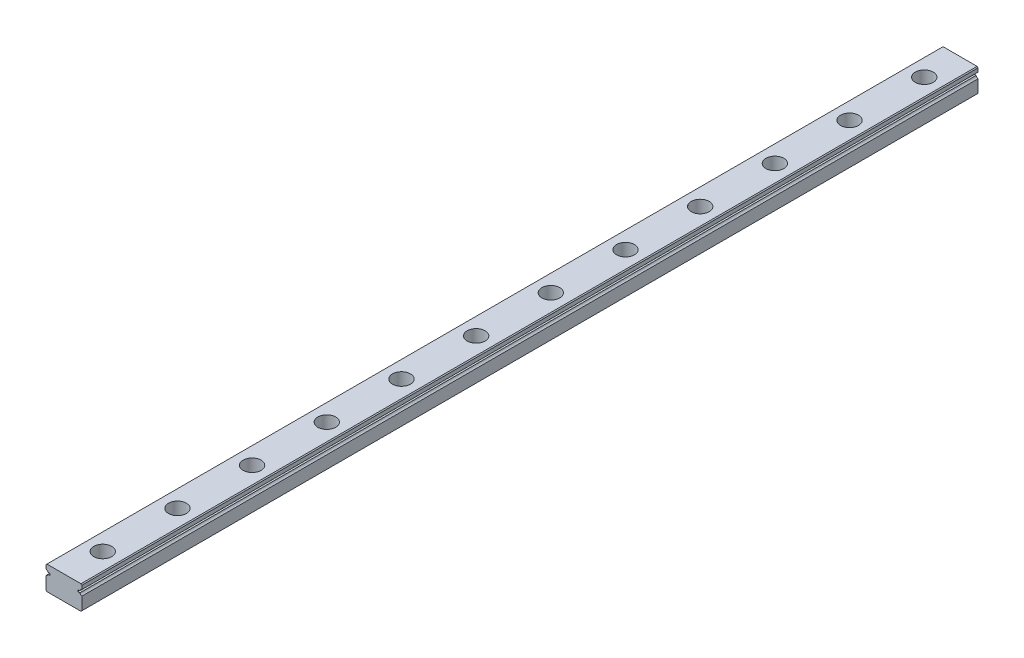
from build123d import *

# Parameters (mm, degrees)
EXTRUDE_1_DEPTH        = 300
SKETCH_2_R             = 3
SKETCH_2_R_2           = 1.75
CUT_EXTRUDE_1_DEPTH    = 4.5
SKETCH_2_2_R           = 1.75
CUT_EXTRUDE_2_DEPTH    = 301.166620396
PATTERN_LINEAR_1_COUNT = 14
PATTERN_LINEAR_1_PITCH = 25


with BuildPart() as part:
    # Эскиз1 → Бобышка-Вытянуть1 (new body)
    with BuildSketch(Plane.XY):
        with BuildLine():
            Line((-6, 3.7), (-5.7, 4))
            Line((-5.7, 4), (5.7, 4))
            Line((5.7, 4), (6, 3.7))
            Line((6, 3.7), (6, 2.451013544))
            ThreePointArc((6, 2.451013544), (5.597935912, 2.202976267), (5.354599002, 1.798050138))
            Line((5.354599002, 1.798050138), (4.643514056, 1.798050138))
            Line((4.643514056, 1.798050138), (4.643514056, 1.201949862))
            Line((4.643514056, 1.201949862), (5.354599002, 1.201949862))
            ThreePointArc((5.354599002, 1.201949862), (5.597935912, 0.797023733), (6, 0.548986456))
            Line((6, 0.548986456), (6, -3.7))
            Line((6, -3.7), (5.7, -4))
            Line((5.7, -4), (-5.7, -4))
            Line((-5.7, -4), (-6, -3.7))
            Line((-6, -3.7), (-6, 0.548986456))
            ThreePointArc((-6, 0.548986456), (-5.597935912, 0.797023733), (-5.354599002, 1.201949862))
            Line((-5.354599002, 1.201949862), (-4.643514056, 1.201949862))
            Line((-4.643514056, 1.201949862), (-4.643514056, 1.798050138))
            Line((-4.643514056, 1.798050138), (-5.354599002, 1.798050138))
            ThreePointArc((-5.354599002, 1.798050138), (-5.597935912, 2.202976267), (-6, 2.451013544))
            Line((-6, 2.451013544), (-6, 3.7))
        make_face()
    extrude(amount=EXTRUDE_1_DEPTH)

    # Эскиз2 → Вырез-Вытянуть1 (cut)
    with BuildSketch(Plane(origin=(0, 4, 0), x_dir=(1, 0, 0), z_dir=(0, 1, 0))):
        with Locations((0, -12)):
            Circle(SKETCH_2_R)
        with Locations((0, -12)):
            Circle(SKETCH_2_R_2, mode=Mode.SUBTRACT)
    cut_extrude_1 = extrude(amount=-CUT_EXTRUDE_1_DEPTH, mode=Mode.SUBTRACT)

    # Эскиз2<2> → Вырез-Вытянуть2 (cut, through all)
    with BuildSketch(Plane(origin=(0, 4, 0), x_dir=(1, 0, 0), z_dir=(0, 1, 0))):
        with Locations((0, -12)):
            Circle(SKETCH_2_2_R)
    cut_extrude_2 = extrude(amount=-CUT_EXTRUDE_2_DEPTH, mode=Mode.SUBTRACT)

    # Линейный массив1: Вырез-Вытянуть1, Вырез-Вытянуть2 ×14
    with Locations(*[(0, 0, i * PATTERN_LINEAR_1_PITCH) for i in range(1, PATTERN_LINEAR_1_COUNT)]):
        add(cut_extrude_1, mode=Mode.SUBTRACT)
        add(cut_extrude_2, mode=Mode.SUBTRACT)


solid = part.part
